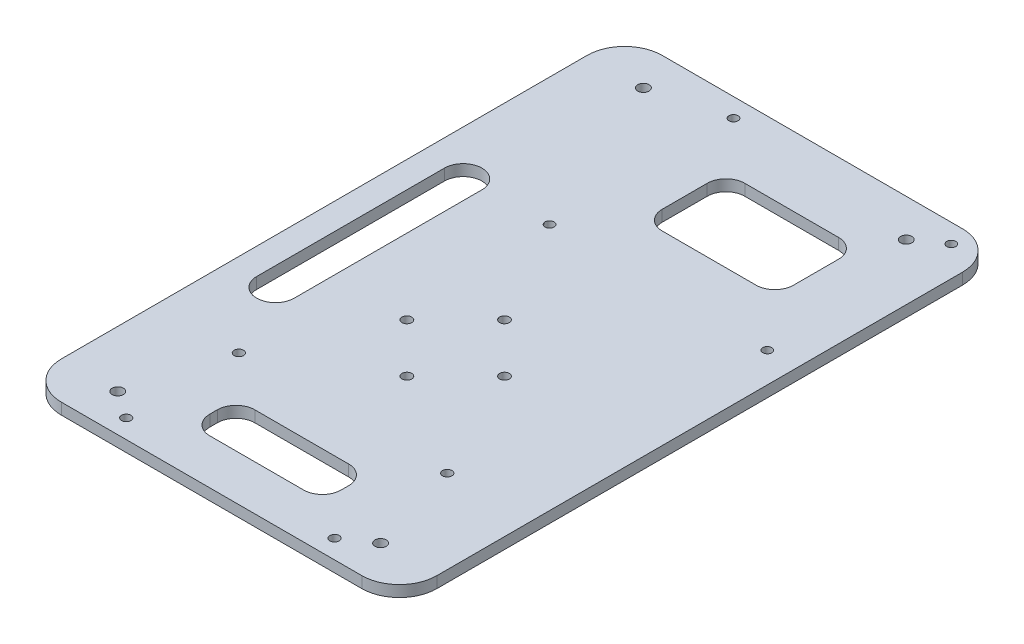
from build123d import *

# Parameters (mm, degrees)
SKETCH_1_W      = 100
SKETCH_1_H      = 160
SKETCH_1_R      = 1.5
SKETCH_1_R_2    = 1.3
SKETCH_1_R_3    = 1.2
SKETCH_1_R_4    = 1.25
SKETCH_1_W_2    = 35
SKETCH_1_H_2    = 12
SKETCH_1_H_3    = 22
EXTRUDE_1_DEPTH = 3
FILLET_1_R      = 10
FILLET_2_R      = 5


with BuildPart() as part:
    # 草图1 → 凸台-拉伸1 (new body)
    with BuildSketch(Plane(origin=(0, 0, 0), x_dir=(1, 0, 0), z_dir=(0, 1, 0))):
        Rectangle(SKETCH_1_W, SKETCH_1_H)
        with Locations(Location((35, 70, 0), (0, 0, 270))):
            Circle(SKETCH_1_R, mode=Mode.SUBTRACT)
        with Locations(Location((-35, 70, 0), (0, 0, 90))):
            Circle(SKETCH_1_R, mode=Mode.SUBTRACT)
        with Locations(Location((-35, -70, 0), (0, 0, 270))):
            Circle(SKETCH_1_R, mode=Mode.SUBTRACT)
        with Locations(Location((35, -70, 0), (0, 0, 90))):
            Circle(SKETCH_1_R, mode=Mode.SUBTRACT)
        with Locations(Location((0, -2, 0), (0, 0, 270))):
            Circle(SKETCH_1_R_2, mode=Mode.SUBTRACT)
        with Locations(Location((13, -15, 0), (0, 0, 270))):
            Circle(SKETCH_1_R_2, mode=Mode.SUBTRACT)
        with Locations(Location((0, -28, 0), (0, 0, 270))):
            Circle(SKETCH_1_R_2, mode=Mode.SUBTRACT)
        with Locations(Location((-13, -15, 0), (0, 0, 270))):
            Circle(SKETCH_1_R_2, mode=Mode.SUBTRACT)
        with Locations(Location((-16, 26, 0), (0, 0, 270))):
            Circle(SKETCH_1_R_3, mode=Mode.SUBTRACT)
        with Locations(Location((42, 26, 0), (0, 0, 270))):
            Circle(SKETCH_1_R_3, mode=Mode.SUBTRACT)
        with Locations(Location((42, 75, 0), (0, 0, 270))):
            Circle(SKETCH_1_R_3, mode=Mode.SUBTRACT)
        with Locations(Location((-16, 75, 0), (0, 0, 270))):
            Circle(SKETCH_1_R_3, mode=Mode.SUBTRACT)
        with Locations(Location((-27.75, -75, 0), (0, 0, 270))):
            Circle(SKETCH_1_R_4, mode=Mode.SUBTRACT)
        with Locations(Location((27.75, -75, 0), (0, 0, 270))):
            Circle(SKETCH_1_R_4, mode=Mode.SUBTRACT)
        with Locations(Location((27.75, -45, 0), (0, 0, 270))):
            Circle(SKETCH_1_R_4, mode=Mode.SUBTRACT)
        with Locations(Location((-27.75, -45, 0), (0, 0, 270))):
            Circle(SKETCH_1_R_4, mode=Mode.SUBTRACT)
        with Locations((0, -62)):
            Rectangle(SKETCH_1_W_2, SKETCH_1_H_2, mode=Mode.SUBTRACT)
        with Locations((13, 50.5)):
            Rectangle(SKETCH_1_W_2, SKETCH_1_H_3, mode=Mode.SUBTRACT)
        with BuildLine():
            Line((-43, -25), (-43, 25))
            ThreePointArc((-43, 25), (-38, 30), (-33, 25))
            Line((-33, 25), (-33, -25))
            ThreePointArc((-33, -25), (-38, -30), (-43, -25))
        make_face(mode=Mode.SUBTRACT)
    extrude(amount=EXTRUDE_1_DEPTH)

    # 圆角1
    fillet_1_edges = [part.edges().sort_by_distance(p)[0] for p in [
        (50, 1.5, 80),
        (-50, 1.5, 80),
        (-50, 1.5, -80),
        (50, 1.5, -80),
    ]]
    fillet(fillet_1_edges, radius=FILLET_1_R)

    # 圆角2
    fillet_2_edges = [part.edges().sort_by_distance(p)[0] for p in [
        (17.5, 1.5, 68),
        (17.5, 1.5, 56),
        (-17.5, 1.5, 56),
        (-17.5, 1.5, 68),
        (30.5, 1.5, -39.5),
        (30.5, 1.5, -61.5),
        (-4.5, 1.5, -61.5),
        (-4.5, 1.5, -39.5),
    ]]
    fillet(fillet_2_edges, radius=FILLET_2_R)


solid = part.part
